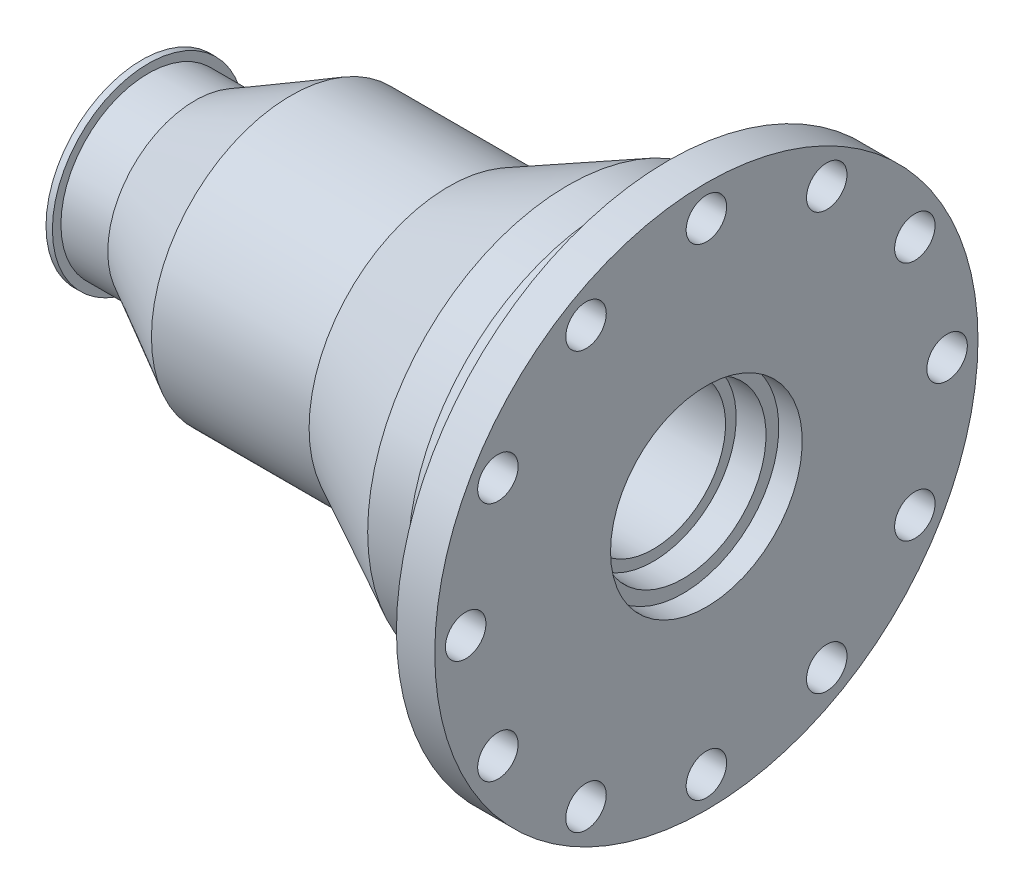
from build123d import *

# Parameters (mm, degrees)
SKETCH_3_R           = 9.5
CUT_EXTRUDE_1_DEPTH  = 321.526909947
SKETCH_4_R           = 9.5
CUT_EXTRUDE_2_DEPTH  = 321.526909947
SKETCH_5_R           = 9.5
CUT_EXTRUDE_3_DEPTH  = 321.526909947
SKETCH_6_R           = 9.5
CUT_EXTRUDE_4_DEPTH  = 321.526909947
SKETCH_7_R           = 9.5
CUT_EXTRUDE_5_DEPTH  = 321.526909947
SKETCH_8_R           = 9.5
CUT_EXTRUDE_6_DEPTH  = 321.526909947
SKETCH_9_R           = 9.5
CUT_EXTRUDE_7_DEPTH  = 321.526909947
SKETCH_10_R          = 9.5
CUT_EXTRUDE_8_DEPTH  = 321.526909947
SKETCH_11_R          = 9.5
CUT_EXTRUDE_9_DEPTH  = 321.526909947
SKETCH_12_R          = 9.5
CUT_EXTRUDE_10_DEPTH = 321.526909947
SKETCH_13_R          = 9.5
CUT_EXTRUDE_11_DEPTH = 321.526909947
SKETCH_14_R          = 9.5
CUT_EXTRUDE_12_DEPTH = 321.526909947


with BuildPart() as part:
    # Эскиз1 → Повернуть1 (revolve)
    with BuildSketch(Plane.XY, mode=Mode.PRIVATE) as revolve_1_sk:
        Polygon((0, 0), (265, 0), (265, 127.5), (247, 127.5), (247, 100), (239, 100), (239, 95), (220, 95), (220, 94), (200, 94), (144, 65.5), (70, 65.5), (25, 41), (3, 41), (3, 45), (0, 45), align=None)
    revolve(revolve_1_sk.sketch.rotate(Axis((0, 0, 0), (1, 0, 0)), 90), axis=Axis((0, 0, 0), (1, 0, 0)))

    # Эскиз2 → Вырез-Повернуть1 (revolve, cut)
    with BuildSketch(Plane.XY, mode=Mode.PRIVATE) as cut_revolve_1_sk:
        Polygon((0, 0), (265, 0), (265, 45), (254, 45), (254, 39), (240, 39), (240, 34), (203.5, 34), (203.5, 31), (0, 31), align=None)
    revolve(cut_revolve_1_sk.sketch.rotate(Axis((0, 0, 0), (1, 0, 0)), 90), axis=Axis((0, 0, 0), (1, 0, 0)), mode=Mode.SUBTRACT)

    # Эскиз3 → Вырез-Вытянуть1 (cut, through all)
    with BuildSketch(Plane(origin=(0, 0, 0), x_dir=(0, 0, -1), z_dir=(1, 0, 0))):
        with Locations((0, 113)):
            Circle(SKETCH_3_R)
    extrude(amount=CUT_EXTRUDE_1_DEPTH, mode=Mode.SUBTRACT)

    # Эскиз4 → Вырез-Вытянуть2 (cut, through all)
    with BuildSketch(Plane(origin=(0, 0, 0), x_dir=(0, 0, -1), z_dir=(1, 0, 0))):
        with Locations((-56.5, 97.860870628)):
            Circle(SKETCH_4_R)
    extrude(amount=CUT_EXTRUDE_2_DEPTH, mode=Mode.SUBTRACT)

    # Эскиз5 → Вырез-Вытянуть3 (cut, through all)
    with BuildSketch(Plane(origin=(0, 0, 0), x_dir=(0, 0, -1), z_dir=(1, 0, 0))):
        with Locations((-97.860870628, 56.5)):
            Circle(SKETCH_5_R)
    extrude(amount=CUT_EXTRUDE_3_DEPTH, mode=Mode.SUBTRACT)

    # Эскиз6 → Вырез-Вытянуть4 (cut, through all)
    with BuildSketch(Plane(origin=(0, 0, 0), x_dir=(0, 0, -1), z_dir=(1, 0, 0))):
        with Locations((-113, 0)):
            Circle(SKETCH_6_R)
    extrude(amount=CUT_EXTRUDE_4_DEPTH, mode=Mode.SUBTRACT)

    # Эскиз7 → Вырез-Вытянуть5 (cut, through all)
    with BuildSketch(Plane(origin=(0, 0, 0), x_dir=(0, 0, -1), z_dir=(1, 0, 0))):
        with Locations((-97.860870628, -56.5)):
            Circle(SKETCH_7_R)
    extrude(amount=CUT_EXTRUDE_5_DEPTH, mode=Mode.SUBTRACT)

    # Эскиз8 → Вырез-Вытянуть6 (cut, through all)
    with BuildSketch(Plane(origin=(0, 0, 0), x_dir=(0, 0, -1), z_dir=(1, 0, 0))):
        with Locations((-56.5, -97.860870628)):
            Circle(SKETCH_8_R)
    extrude(amount=CUT_EXTRUDE_6_DEPTH, mode=Mode.SUBTRACT)

    # Эскиз9 → Вырез-Вытянуть7 (cut, through all)
    with BuildSketch(Plane(origin=(0, 0, 0), x_dir=(0, 0, -1), z_dir=(1, 0, 0))):
        with Locations((0, -113)):
            Circle(SKETCH_9_R)
    extrude(amount=CUT_EXTRUDE_7_DEPTH, mode=Mode.SUBTRACT)

    # Эскиз10 → Вырез-Вытянуть8 (cut, through all)
    with BuildSketch(Plane(origin=(0, 0, 0), x_dir=(0, 0, -1), z_dir=(1, 0, 0))):
        with Locations((56.5, -97.860870628)):
            Circle(SKETCH_10_R)
    extrude(amount=CUT_EXTRUDE_8_DEPTH, mode=Mode.SUBTRACT)

    # Эскиз11 → Вырез-Вытянуть9 (cut, through all)
    with BuildSketch(Plane(origin=(0, 0, 0), x_dir=(0, 0, -1), z_dir=(1, 0, 0))):
        with Locations((97.860870628, -56.5)):
            Circle(SKETCH_11_R)
    extrude(amount=CUT_EXTRUDE_9_DEPTH, mode=Mode.SUBTRACT)

    # Эскиз12 → Вырез-Вытянуть10 (cut, through all)
    with BuildSketch(Plane(origin=(0, 0, 0), x_dir=(0, 0, -1), z_dir=(1, 0, 0))):
        with Locations((113, 0)):
            Circle(SKETCH_12_R)
    extrude(amount=CUT_EXTRUDE_10_DEPTH, mode=Mode.SUBTRACT)

    # Эскиз13 → Вырез-Вытянуть11 (cut, through all)
    with BuildSketch(Plane(origin=(0, 0, 0), x_dir=(0, 0, -1), z_dir=(1, 0, 0))):
        with Locations((97.860870628, 56.5)):
            Circle(SKETCH_13_R)
    extrude(amount=CUT_EXTRUDE_11_DEPTH, mode=Mode.SUBTRACT)

    # Эскиз14 → Вырез-Вытянуть12 (cut, through all)
    with BuildSketch(Plane(origin=(0, 0, 0), x_dir=(0, 0, -1), z_dir=(1, 0, 0))):
        with Locations((56.5, 97.860870628)):
            Circle(SKETCH_14_R)
    extrude(amount=CUT_EXTRUDE_12_DEPTH, mode=Mode.SUBTRACT)


solid = part.part
